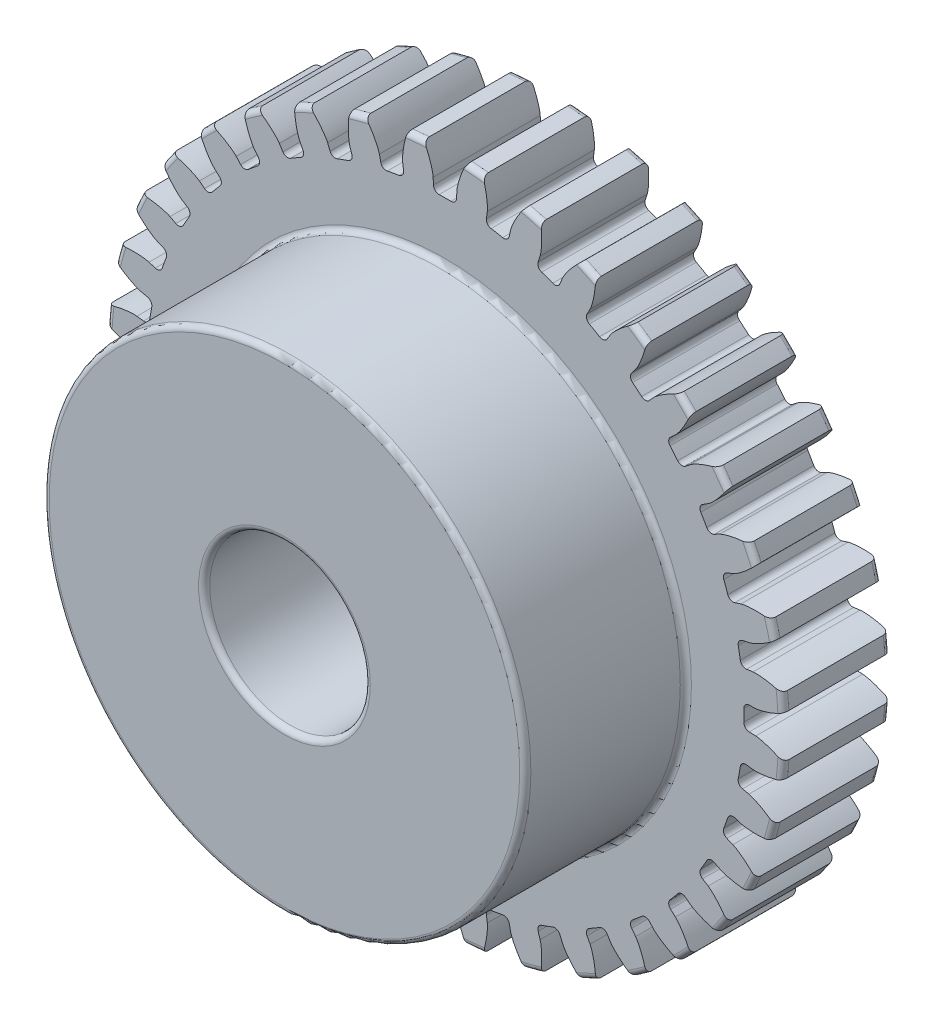
from build123d import *

# Parameters (mm, degrees)
BOSS_EXTRUDE1_DEPTH      = 7.9375
BOSS_EXTRUDE1_DEPTH_BACK = 7.9375
SKETCH3_R                = 20.108333333
SKETCH5_W                = 9.525
SKETCH5_H                = 5.820833333
SKETCH5_W_2              = 15.875
SKETCH5_H_2              = 4.7625
FILLET2_R                = 0.330829709
CUT_EXTRUDE1_DEPTH       = 30.524465223
FILLET1_R                = 0.330829709
CIRPATTERN1_COUNT        = 36
FILLET1_OF_CIRPATTERN1_R = 0.330829709


with BuildPart() as part:
    # Sketch3 → Boss-Extrude1 (new, two sides: drawn at the far end of the back side and taken through both)
    with BuildSketch(Plane.XY.offset(-BOSS_EXTRUDE1_DEPTH_BACK)):
        Circle(SKETCH3_R)
    extrude(amount=BOSS_EXTRUDE1_DEPTH + BOSS_EXTRUDE1_DEPTH_BACK)

    # Sketch5 → Cut-Revolve1 (revolve, cut)
    with BuildSketch(Plane(origin=(0, 0, 0), x_dir=(0, 0, -1), z_dir=(1, 0, 0)), mode=Mode.PRIVATE) as cut_revolve1_sk:
        with Locations((-3.175, 17.197916666)):
            Rectangle(SKETCH5_W, SKETCH5_H)
        with Locations((0, 2.38125)):
            Rectangle(SKETCH5_W_2, SKETCH5_H_2)
    revolve(cut_revolve1_sk.sketch.rotate(Axis((0, 0, 7.9375), (0, 0, -1)), 90), axis=Axis((0, 0, 7.9375), (0, 0, -1)), mode=Mode.SUBTRACT)

    # Fillet2
    fillet2_edges = [part.edges().sort_by_distance(p)[0] for p in [
        (-4.7625, 0, 7.9375),
        (-4.7625, 0, -7.9375),
        (-14.2875, 0, 7.9375),
        (-14.2875, 0, -1.5875),
        (-20.108333333, 0, -1.5875),
        (-20.108333333, 0, -7.9375),
    ]]
    fillet(fillet2_edges, radius=FILLET2_R)

    # Sketch4 → Cut-Extrude1 (cut, symmetric)
    with BuildSketch(Plane.XY):
        with BuildLine():
            Line((17.714226323, 0.675032795), (18.429836149, 0.702302408))
            add(Edge.make_bspline(
                [(18.429836149, 0.702302408), (18.432406582, 0.702424024), (18.439613343, 0.702838335), (18.45322775, 0.703910757), (18.475429785, 0.706071613), (18.503699605, 0.709429273), (18.540217762, 0.71446366), (18.583209687, 0.721288279), (18.63042905, 0.729725862), (18.681772112, 0.739918562), (18.73296784, 0.750983815), (18.784013196, 0.762857457), (18.834839371, 0.775439527), (18.896378392, 0.791572814), (18.970130276, 0.812159029), (19.056276822, 0.838032633), (19.153910409, 0.869517155), (19.253343124, 0.903899594), (19.351124832, 0.93961861), (19.449852607, 0.977883638), (19.545329269, 1.016448631), (19.644435147, 1.058742883), (19.735880415, 1.098919057), (19.838263332, 1.14641483), (19.920866247, 1.185468434), (20.006139761, 1.227887979), (20.04763509, 1.248840704), (20.068838535, 1.259678257)],
                knots=[0, 0, 0, 0, 0, 0.005376749, 0.015083688, 0.02853182, 0.04661014, 0.06485485, 0.092110526, 0.119476176, 0.146842496, 0.174208854, 0.201574956, 0.228941013, 0.256307345, 0.307035032, 0.361767352, 0.416499661, 0.471231937, 0.525964282, 0.580696616, 0.635428982, 0.690161387, 0.744893688, 0.799626082, 0.854358407, 0.909090914, 0.909090914, 0.909090914, 0.909090914, 0.909090914], degree=4))
            ThreePointArc((20.068838535, 1.259678257), (20.108333333, 0), (20.068838535, -1.259678257))
            add(Edge.make_bspline(
                [(18.429836149, -0.702302408), (18.432406582, -0.702424024), (18.439613343, -0.702838335), (18.45322775, -0.703910757), (18.475429785, -0.706071613), (18.503699605, -0.709429273), (18.540217762, -0.71446366), (18.583209687, -0.721288279), (18.63042905, -0.729725862), (18.681772112, -0.739918562), (18.73296784, -0.750983815), (18.784013196, -0.762857457), (18.834839371, -0.775439527), (18.896378392, -0.791572814), (18.970130276, -0.812159029), (19.056276822, -0.838032633), (19.153910409, -0.869517155), (19.253343124, -0.903899594), (19.351124832, -0.93961861), (19.449852607, -0.977883638), (19.545329269, -1.016448631), (19.644435147, -1.058742883), (19.735880415, -1.098919057), (19.838263332, -1.14641483), (19.920866247, -1.185468434), (20.006139761, -1.227887979), (20.04763509, -1.248840704), (20.068838535, -1.259678257)],
                knots=[0, 0, 0, 0, 0, 0.005376749, 0.015083688, 0.02853182, 0.04661014, 0.06485485, 0.092110526, 0.119476176, 0.146842496, 0.174208854, 0.201574956, 0.228941013, 0.256307345, 0.307035032, 0.361767352, 0.416499661, 0.471231937, 0.525964282, 0.580696616, 0.635428982, 0.690161387, 0.744893688, 0.799626082, 0.854358407, 0.909090914, 0.909090914, 0.909090914, 0.909090914, 0.909090914], degree=4))
            Line((18.429836149, -0.702302408), (17.714226323, -0.675032795))
            ThreePointArc((17.714226323, -0.675032795), (17.727083333, 0), (17.714226323, 0.675032795))
        make_face()
    cut_extrude1 = extrude(amount=CUT_EXTRUDE1_DEPTH, both=True, mode=Mode.SUBTRACT)

    # Fillet1
    fillet1_edges = [part.edges().sort_by_distance(p)[0] for p in [
        (17.714226323, -0.675032795, -4.7625),
        (17.714226323, 0.675032795, -4.7625),
    ]]
    fillet(fillet1_edges, radius=FILLET1_R)

    # CirPattern1: Cut-Extrude1 ×36 about axis
    cirpattern1_axis = Axis((0, 0, 7.9375), (0, 0, -1))
    for i in range(1, CIRPATTERN1_COUNT):
        add(cut_extrude1.rotate(cirpattern1_axis, i * 360 / CIRPATTERN1_COUNT), mode=Mode.SUBTRACT)

    # Fillet1 of CirPattern1
    fillet1_of_cirpattern1_edges = [part.edges().sort_by_distance(p)[0] for p in [
        (17.327889207, -3.740820649, -4.7625),
        (17.562325636, -2.41126559, -4.7625),
        (16.415052946, -6.692945562, -4.7625),
        (16.876802572, -5.42429889, -4.7625),
        (15.003453607, -9.44170871, -4.7625),
        (15.678486402, -8.272517613, -4.7625),
        (13.135981923, -11.903590317, -4.7625),
        (14.003787356, -10.869380075, -4.7625),
        (10.869380075, -14.003787356, -4.7625),
        (11.903590317, -13.135981923, -4.7625),
        (8.272517613, -15.678486402, -4.7625),
        (9.44170871, -15.003453607, -4.7625),
        (5.42429889, -16.876802572, -4.7625),
        (6.692945562, -16.415052946, -4.7625),
        (2.41126559, -17.562325636, -4.7625),
        (3.740820649, -17.327889207, -4.7625),
        (-0.675032795, -17.714226323, -4.7625),
        (0.675032795, -17.714226323, -4.7625),
        (-3.740820649, -17.327889207, -4.7625),
        (-2.41126559, -17.562325636, -4.7625),
        (-6.692945562, -16.415052946, -4.7625),
        (-5.42429889, -16.876802572, -4.7625),
        (-9.44170871, -15.003453607, -4.7625),
        (-8.272517613, -15.678486402, -4.7625),
        (-11.903590317, -13.135981923, -4.7625),
        (-10.869380075, -14.003787356, -4.7625),
        (-14.003787356, -10.869380075, -4.7625),
        (-13.135981923, -11.903590317, -4.7625),
        (-15.678486402, -8.272517613, -4.7625),
        (-15.003453607, -9.44170871, -4.7625),
        (-16.876802572, -5.42429889, -4.7625),
        (-16.415052946, -6.692945562, -4.7625),
        (-17.562325636, -2.41126559, -4.7625),
        (-17.327889207, -3.740820649, -4.7625),
        (-17.714226323, 0.675032795, -4.7625),
        (-17.714226323, -0.675032795, -4.7625),
        (-17.327889207, 3.740820649, -4.7625),
        (-17.562325636, 2.41126559, -4.7625),
        (-16.415052946, 6.692945562, -4.7625),
        (-16.876802572, 5.42429889, -4.7625),
        (-15.003453607, 9.44170871, -4.7625),
        (-15.678486402, 8.272517613, -4.7625),
        (-13.135981923, 11.903590317, -4.7625),
        (-14.003787356, 10.869380075, -4.7625),
        (-10.869380075, 14.003787356, -4.7625),
        (-11.903590317, 13.135981923, -4.7625),
        (-8.272517613, 15.678486402, -4.7625),
        (-9.44170871, 15.003453607, -4.7625),
        (-5.42429889, 16.876802572, -4.7625),
        (-6.692945562, 16.415052946, -4.7625),
        (-2.41126559, 17.562325636, -4.7625),
        (-3.740820649, 17.327889207, -4.7625),
        (0.675032795, 17.714226323, -4.7625),
        (-0.675032795, 17.714226323, -4.7625),
        (3.740820649, 17.327889207, -4.7625),
        (2.41126559, 17.562325636, -4.7625),
        (6.692945562, 16.415052946, -4.7625),
        (5.42429889, 16.876802572, -4.7625),
        (9.44170871, 15.003453607, -4.7625),
        (8.272517613, 15.678486402, -4.7625),
        (11.903590317, 13.135981923, -4.7625),
        (10.869380075, 14.003787356, -4.7625),
        (14.003787356, 10.869380075, -4.7625),
        (13.135981923, 11.903590317, -4.7625),
        (15.678486402, 8.272517613, -4.7625),
        (15.003453607, 9.44170871, -4.7625),
        (16.876802572, 5.42429889, -4.7625),
        (16.415052946, 6.692945562, -4.7625),
        (17.562325636, 2.41126559, -4.7625),
        (17.327889207, 3.740820649, -4.7625),
    ]]
    fillet(fillet1_of_cirpattern1_edges, radius=FILLET1_OF_CIRPATTERN1_R)


solid = part.part
